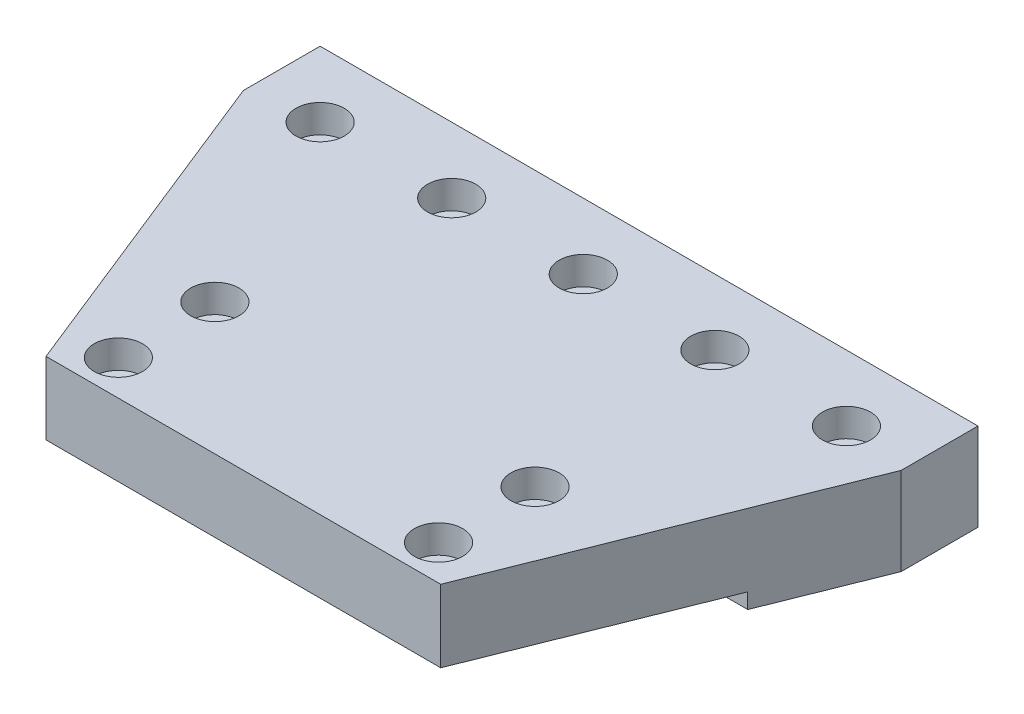
from build123d import *

# Parameters (mm, degrees)
SKETCH1_W                                           = 150
SKETCH1_H                                           = 92.5
BOSS_EXTRUDE1_DEPTH                                 = 10
CHAMFER2_SIZE                                       = 75
CHAMFER2_SIZE2                                      = 30
CHAMFER3_SIZE                                       = 30
CHAMFER3_SIZE2                                      = 75
CBORE_FOR_M6_HEX_SOCKET_HEAD_CAP_SCREW1_D           = 6.6
CBORE_FOR_M6_HEX_SOCKET_HEAD_CAP_SCREW1_CBORE_D     = 11
CBORE_FOR_M6_HEX_SOCKET_HEAD_CAP_SCREW1_CBORE_DEPTH = 6.4
CBORE_FOR_M6_HEX_SOCKET_HEAD_CAP_SCREW2_D           = 6.6
CBORE_FOR_M6_HEX_SOCKET_HEAD_CAP_SCREW2_CBORE_D     = 11
CBORE_FOR_M6_HEX_SOCKET_HEAD_CAP_SCREW2_CBORE_DEPTH = 6.4
SKETCH11_W                                          = 150
SKETCH11_H                                          = 60
CUT_EXTRUDE1_DEPTH                                  = 3.5


with BuildPart() as part:
    # Sketch1 → Boss-Extrude1 (new, symmetric)
    with BuildSketch(Plane(origin=(0, 0, 0), x_dir=(1, 0, 0), z_dir=(0, 1, 0))):
        Rectangle(SKETCH1_W, SKETCH1_H)
    extrude(amount=BOSS_EXTRUDE1_DEPTH, both=True)

    # Chamfer2
    chamfer2_edges = [part.edges().sort_by_distance(p)[0] for p in [
        (-75, 0, 46.25),
    ]]
    chamfer2_side = [part.faces().sort_by_distance(p)[0] for p in [
        (-75, 0, 0),
    ]]
    chamfer(chamfer2_edges, length=CHAMFER2_SIZE, length2=CHAMFER2_SIZE2, reference=chamfer2_side[0])

    # Chamfer3
    chamfer3_edges = [part.edges().sort_by_distance(p)[0] for p in [
        (75, 0, 46.25),
    ]]
    chamfer3_side = [part.faces().sort_by_distance(p)[0] for p in [
        (15, 0, 46.25),
    ]]
    chamfer(chamfer3_edges, length=CHAMFER3_SIZE, length2=CHAMFER3_SIZE2, reference=chamfer3_side[0])

    # CBORE for M6 Hex Socket Head Cap Screw1 (through all)
    with Locations(Plane(origin=(0, 10, 0), x_dir=(1, 0, 0), z_dir=(0, 1, 0))):
        with Locations((-60, 31.25), (-30, 31.25), (0, 31.25), (30, 31.25), (60, 31.25)):
            CounterBoreHole(CBORE_FOR_M6_HEX_SOCKET_HEAD_CAP_SCREW1_D / 2, CBORE_FOR_M6_HEX_SOCKET_HEAD_CAP_SCREW1_CBORE_D / 2, CBORE_FOR_M6_HEX_SOCKET_HEAD_CAP_SCREW1_CBORE_DEPTH)

    # CBORE for M6 Hex Socket Head Cap Screw2 (through all)
    with Locations(Plane(origin=(0, 10, 0), x_dir=(1, 0, 0), z_dir=(0, 1, 0))):
        with Locations((-36.5, -38.25), (-36.5, -16.25), (36.5, -16.25), (36.5, -38.25)):
            CounterBoreHole(CBORE_FOR_M6_HEX_SOCKET_HEAD_CAP_SCREW2_D / 2, CBORE_FOR_M6_HEX_SOCKET_HEAD_CAP_SCREW2_CBORE_D / 2, CBORE_FOR_M6_HEX_SOCKET_HEAD_CAP_SCREW2_CBORE_DEPTH)

    # Sketch11 → Cut-Extrude1 (cut)
    with BuildSketch(Plane.XZ.offset(10)):
        with Locations((0, 26.25)):
            Rectangle(SKETCH11_W, SKETCH11_H)
    extrude(amount=-CUT_EXTRUDE1_DEPTH, mode=Mode.SUBTRACT)


solid = part.part
